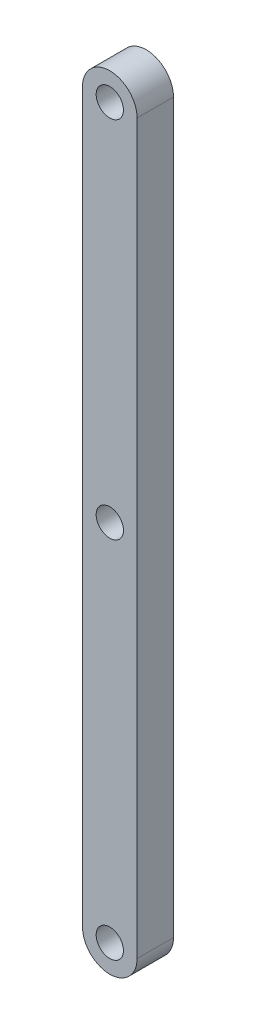
from build123d import *

# Parameters (mm, degrees)
CROQUIS1_R              = 7.5
SALIENTE_EXTRUIR1_DEPTH = 20


with BuildPart() as part:
    # Croquis1 → Saliente-Extruir1 (new body)
    with BuildSketch(Plane.XY):
        with BuildLine():
            Line((-15, 0), (-15, 400))
            ThreePointArc((-15, 400), (0, 415), (15, 400))
            Line((15, 400), (15, 0))
            ThreePointArc((15, 0), (0, -15), (-15, 0))
        make_face()
        with Locations((0, 400)):
            Circle(CROQUIS1_R, mode=Mode.SUBTRACT)
        with Locations((0, 200)):
            Circle(CROQUIS1_R, mode=Mode.SUBTRACT)
        Circle(CROQUIS1_R, mode=Mode.SUBTRACT)
    extrude(amount=SALIENTE_EXTRUIR1_DEPTH)


solid = part.part
